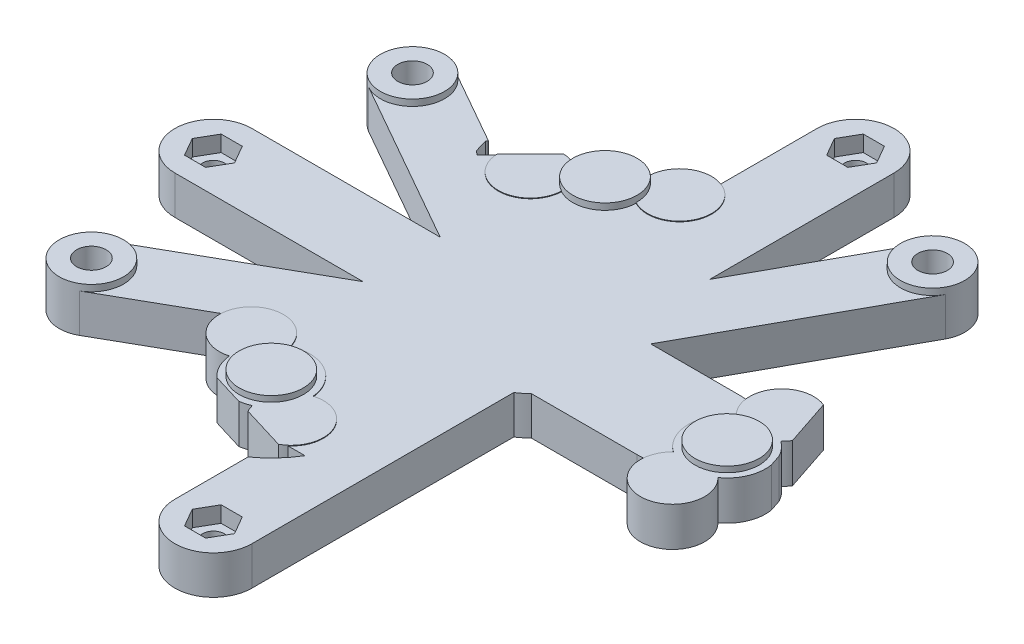
from build123d import *
from build123d.topology import SkipClean

# Parameters (mm, degrees)
BASE_OUTLINE_SKETCH_R          = 3.95
BASE_OUTLINE_SKETCH_R_2        = 1.75
BASE_OUTLINE_SKETCH_R_3        = 3.1
BASE_OUTLINE_SKETCH_R_4        = 2.3
BASE_OUTLINE_DEPTH             = 1.4
INTERFACE_PROFILE_2_SKETCH_R   = 3.95
INTERFACE_PROFILE_2_SKETCH_R_2 = 1.75
INTERFACE_PROFILE_2_SKETCH_R_3 = 1.7
INTERFACE_PROFILE_2_SKETCH_R_4 = 2.3
INTERFACE_PROFILE_2_DEPTH      = 0.1
INTERFACE_PROFILE_3_SKETCH_R   = 1.75
INTERFACE_PROFILE_3_SKETCH_R_2 = 1.7
INTERFACE_PROFILE_3_SKETCH_R_3 = 2.3
INTERFACE_PROFILE_3_DEPTH      = 0.5
INTERFACE_PROFILE_4_SKETCH_R   = 1.75
INTERFACE_PROFILE_4_SKETCH_R_2 = 1.7
INTERFACE_PROFILE_4_SKETCH_R_3 = 2.3
INTERFACE_PROFILE_4_DEPTH      = 1.5
INTERFACE_PROFILE_5_SKETCH_R   = 1.75
INTERFACE_PROFILE_5_SKETCH_R_2 = 2.3
INTERFACE_PROFILE_5_DEPTH      = 0.5
INTERFACE_PROFILE_6_SKETCH_R   = 1.1
INTERFACE_PROFILE_6_SKETCH_R_2 = 2.3
INTERFACE_PROFILE_6_DEPTH      = 1.3
INTERFACE_PROFILE_7_SKETCH_R   = 2.3
INTERFACE_PROFILE_7_DEPTH      = 0.7
INTERFACE_PROFILE_8_SKETCH_R   = 5
INTERFACE_PROFILE_8_SKETCH_R_2 = 2.3
INTERFACE_PROFILE_8_DEPTH      = 0.1
INTERFACE_PROFILE_9_SKETCH_R   = 5
INTERFACE_PROFILE_9_SKETCH_R_2 = 2.3
INTERFACE_PROFILE_9_DEPTH      = 0.9


with BuildPart() as part:
    # Base Outline Sketch → Base Outline (new body)
    with BuildSketch(Plane(origin=(0, -71, 0), x_dir=(1, 0, 0), z_dir=(0, 1, 0))):
        with BuildLine():
            Line((-32.291651246, 8), (-46.185295141, 8))
            Line((-46.185295141, 8), (-29.910571703, 37.590406251))
            ThreePointArc((-29.910571703, 37.590406251), (-31.882057497, 44.381079543), (-38.672730789, 42.409593749))
            Line((-38.672730789, 42.409593749), (-50.291651246, 21.284283828))
            Line((-50.291651246, 21.284283828), (-50.291651246, 50))
            ThreePointArc((-50.291651246, 50), (-56.291651246, 56), (-62.291651246, 50))
            Line((-62.291651246, 50), (-62.291651246, 34.954572734))
            ThreePointArc((-62.291651246, 34.954572734), (-66.315093544, 34.625464052), (-68.784082024, 31.431642464))
            ThreePointArc((-68.784082024, 31.431642464), (-68.883668242, 30.913025667), (-68.927999999, 30.386798062))
            ThreePointArc((-68.927999999, 30.386798062), (-73.791651246, 30.310889132), (-76.289215931, 26.136798062))
            ThreePointArc((-76.289215931, 26.136798062), (-77.35512684, 26.559413065), (-78.489286926, 26.728085547))
            Line((-78.489286926, 26.728085547), (-83.649541024, 21.548414964))
            ThreePointArc((-83.649541024, 21.548414964), (-83.643005829, 21.416889138), (-83.633009125, 21.285581035))
            Line((-83.633009125, 21.285581035), (-83.8107686, 21.386580737))
            Line((-83.8107686, 21.386580737), (-85.20343943, 19.988669705))
            Line((-85.20343943, 19.988669705), (-85.757211082, 20.413215201))
            ThreePointArc((-85.757211082, 20.413215201), (-86.105522751, 21.420146909), (-86.383835717, 22.448628496))
            Line((-86.383835717, 22.448628496), (-86.305419253, 22.677221962))
            Line((-86.305419253, 22.677221962), (-86.256166384, 22.776011296))
            Line((-86.256166384, 22.776011296), (-97.821604208, 29.347282787))
            ThreePointArc((-97.821604208, 29.347282787), (-104.638934033, 27.470047038), (-102.761698284, 20.652717213))
            Line((-102.761698284, 20.652717213), (-76.972915989, 6))
            Line((-76.972915989, 6), (-106.291651246, 6))
            ThreePointArc((-106.291651246, 6), (-112.291651246, 0), (-106.291651246, -6))
            Line((-106.291651246, -6), (-76.972915989, -6))
            Line((-76.972915989, -6), (-102.761698284, -20.652717213))
            ThreePointArc((-102.761698284, -20.652717213), (-105.125718578, -26.277416546), (-100.291651246, -30))
            ThreePointArc((-100.291651246, -30), (-99.0142347, -29.834067332), (-97.821604208, -29.347282787))
            Line((-97.821604208, -29.347282787), (-83.633009125, -21.285581035))
            ThreePointArc((-83.633009125, -21.285581035), (-81.833429855, -25.588743588), (-77.266036714, -26.53458364))
            ThreePointArc((-77.266036714, -26.53458364), (-76.660851993, -28.65876199), (-75.328083566, -30.420042925))
            Line((-75.328083566, -30.420042925), (-70.4166073, -31.916610671))
            ThreePointArc((-70.4166073, -31.916610671), (-69.583050502, -31.73234307), (-68.784082024, -31.431642464))
            ThreePointArc((-68.784082024, -31.431642464), (-68.607205612, -31.999326383), (-68.36419026, -32.541999246))
            Line((-68.36419026, -32.541999246), (-61.538896036, -34.621723271))
            ThreePointArc((-61.538896036, -34.621723271), (-61.075070248, -34.33525847), (-60.645188633, -34))
            Line((-60.645188633, -34), (-58.027344867, -34))
            ThreePointArc((-58.027344867, -34), (-59.924361539, -36.5180637), (-62.291651246, -38.600191578))
            Line((-62.291651246, -38.600191578), (-62.291651246, -50))
            ThreePointArc((-62.291651246, -50), (-56.291651246, -56), (-50.291651246, -50))
            Line((-50.291651246, -50), (-50.291651246, -9.219544457))
            ThreePointArc((-50.291651246, -9.219544457), (-49.489348292, -8.644574861), (-48.741816811, -8))
            Line((-48.741816811, -8), (-32.291651246, -8))
            ThreePointArc((-32.291651246, -8), (-31.774449966, -7.983263921), (-31.259412667, -7.933125709))
            ThreePointArc((-31.259412667, -7.933125709), (-24.59824207, -13.204504795), (-22.824835001, -4.897058824))
            ThreePointArc((-22.824835001, -4.897058824), (-20.756368573, -2.315306833), (-20.370627571, 0.970298223))
            Line((-20.370627571, 0.970298223), (-20.9711323, 2.773459598))
            ThreePointArc((-20.9711323, 2.773459598), (-21.771503753, 3.945664284), (-22.824835001, 4.897058823))
            ThreePointArc((-22.824835001, 4.897058823), (-22.387173453, 5.376691952), (-22.015356327, 5.908995993))
            Line((-22.015356327, 5.908995993), (-24.422675355, 13.137556374))
            ThreePointArc((-24.422675355, 13.137556374), (-29.320205782, 12.478423987), (-31.259412667, 7.933125709))
            ThreePointArc((-31.259412667, 7.933125709), (-31.774449966, 7.983263921), (-32.291651246, 8))
        make_face()
        with Locations(Location((-71.291651246, -25.980762114, 0), (0, 0, 270))):
            Circle(BASE_OUTLINE_SKETCH_R, mode=Mode.SUBTRACT)
        with Locations(Location((-63.930435314, -30.230762114, 0), (0, 0, 270))):
            Circle(BASE_OUTLINE_SKETCH_R_2, mode=Mode.SUBTRACT)
        with Locations(Location((-26.291651246, 0, 0), (0, 0, 270))):
            Circle(BASE_OUTLINE_SKETCH_R, mode=Mode.SUBTRACT)
        with Locations(Location((-56.291651246, -50, 0), (0, 0, 270))):
            Circle(BASE_OUTLINE_SKETCH_R_3, mode=Mode.SUBTRACT)
        with Locations(Location((-26.291651246, -8.5, 0), (0, 0, 270))):
            Circle(BASE_OUTLINE_SKETCH_R_2, mode=Mode.SUBTRACT)
        with Locations(Location((-78.652867178, -21.730762114, 0), (0, 0, 270))):
            Circle(BASE_OUTLINE_SKETCH_R_2, mode=Mode.SUBTRACT)
        with Locations(Location((-100.291651246, -25, 0), (0, 0, 270))):
            Circle(BASE_OUTLINE_SKETCH_R_4, mode=Mode.SUBTRACT)
        with Locations(Location((-71.291651246, 25.980762113, 0), (0, 0, 270))):
            Circle(BASE_OUTLINE_SKETCH_R, mode=Mode.SUBTRACT)
        with Locations(Location((-34.291651246, 40, 0), (0, 0, 270))):
            Circle(BASE_OUTLINE_SKETCH_R_4, mode=Mode.SUBTRACT)
        with Locations(Location((-26.291651246, 8.5, 0), (0, 0, 270))):
            Circle(BASE_OUTLINE_SKETCH_R_2, mode=Mode.SUBTRACT)
        with Locations(Location((-63.930435314, 30.230762113, 0), (0, 0, 270))):
            Circle(BASE_OUTLINE_SKETCH_R_2, mode=Mode.SUBTRACT)
        with Locations(Location((-56.291651246, 50, 0), (0, 0, 270))):
            Circle(BASE_OUTLINE_SKETCH_R_3, mode=Mode.SUBTRACT)
        with Locations(Location((-78.652867178, 21.730762114, 0), (0, 0, 270))):
            Circle(BASE_OUTLINE_SKETCH_R_2, mode=Mode.SUBTRACT)
        with Locations(Location((-106.291651246, 0, 0), (0, 0, 270))):
            Circle(BASE_OUTLINE_SKETCH_R_3, mode=Mode.SUBTRACT)
        with Locations(Location((-100.291651246, 25, 0), (0, 0, 270))):
            Circle(BASE_OUTLINE_SKETCH_R_4, mode=Mode.SUBTRACT)
    extrude(amount=BASE_OUTLINE_DEPTH)

    # Interface Profile 2 Sketch → Interface Profile 2 (add)
    with BuildSketch(Plane(origin=(0, -69.6, 0), x_dir=(1, 0, 0), z_dir=(0, 1, 0))):
        with BuildLine():
            Line((-32.291651246, 8), (-46.185295141, 8))
            Line((-46.185295141, 8), (-29.910571703, 37.590406251))
            ThreePointArc((-29.910571703, 37.590406251), (-31.882057497, 44.381079543), (-38.672730789, 42.409593749))
            Line((-38.672730789, 42.409593749), (-50.291651246, 21.284283828))
            Line((-50.291651246, 21.284283828), (-50.291651246, 50))
            ThreePointArc((-50.291651246, 50), (-56.291651246, 56), (-62.291651246, 50))
            Line((-62.291651246, 50), (-62.291651246, 34.954572734))
            ThreePointArc((-62.291651246, 34.954572734), (-66.315093544, 34.625464052), (-68.784082024, 31.431642464))
            ThreePointArc((-68.784082024, 31.431642464), (-68.883668242, 30.913025667), (-68.927999999, 30.386798062))
            ThreePointArc((-68.927999999, 30.386798062), (-73.791651246, 30.310889132), (-76.289215931, 26.136798062))
            ThreePointArc((-76.289215931, 26.136798062), (-77.35512684, 26.559413065), (-78.489286926, 26.728085547))
            Line((-78.489286926, 26.728085547), (-83.649541024, 21.548414964))
            ThreePointArc((-83.649541024, 21.548414964), (-83.643005829, 21.416889138), (-83.633009125, 21.285581035))
            Line((-83.633009125, 21.285581035), (-83.8107686, 21.386580737))
            Line((-83.8107686, 21.386580737), (-85.20343943, 19.988669705))
            Line((-85.20343943, 19.988669705), (-85.757211082, 20.413215201))
            ThreePointArc((-85.757211082, 20.413215201), (-86.105522751, 21.420146909), (-86.383835717, 22.448628496))
            Line((-86.383835717, 22.448628496), (-86.305419253, 22.677221962))
            Line((-86.305419253, 22.677221962), (-86.256166384, 22.776011296))
            Line((-86.256166384, 22.776011296), (-97.821604208, 29.347282787))
            ThreePointArc((-97.821604208, 29.347282787), (-104.638934033, 27.470047038), (-102.761698284, 20.652717213))
            Line((-102.761698284, 20.652717213), (-76.972915989, 6))
            Line((-76.972915989, 6), (-106.291651246, 6))
            ThreePointArc((-106.291651246, 6), (-112.291651246, 0), (-106.291651246, -6))
            Line((-106.291651246, -6), (-76.972915989, -6))
            Line((-76.972915989, -6), (-102.761698284, -20.652717213))
            ThreePointArc((-102.761698284, -20.652717213), (-105.125718578, -26.277416546), (-100.291651246, -30))
            ThreePointArc((-100.291651246, -30), (-99.0142347, -29.834067332), (-97.821604208, -29.347282787))
            Line((-97.821604208, -29.347282787), (-83.633009125, -21.285581035))
            ThreePointArc((-83.633009125, -21.285581035), (-81.833429855, -25.588743588), (-77.266036714, -26.53458364))
            ThreePointArc((-77.266036714, -26.53458364), (-76.660851993, -28.65876199), (-75.328083566, -30.420042925))
            Line((-75.328083566, -30.420042925), (-70.4166073, -31.916610671))
            ThreePointArc((-70.4166073, -31.916610671), (-69.583050502, -31.73234307), (-68.784082024, -31.431642464))
            ThreePointArc((-68.784082024, -31.431642464), (-68.607205612, -31.999326383), (-68.36419026, -32.541999246))
            Line((-68.36419026, -32.541999246), (-61.538896036, -34.621723271))
            ThreePointArc((-61.538896036, -34.621723271), (-61.075070248, -34.33525847), (-60.645188633, -34))
            Line((-60.645188633, -34), (-58.027344867, -34))
            ThreePointArc((-58.027344867, -34), (-59.924361539, -36.5180637), (-62.291651246, -38.600191578))
            Line((-62.291651246, -38.600191578), (-62.291651246, -50))
            ThreePointArc((-62.291651246, -50), (-56.291651246, -56), (-50.291651246, -50))
            Line((-50.291651246, -50), (-50.291651246, -9.219544457))
            ThreePointArc((-50.291651246, -9.219544457), (-49.489348292, -8.644574861), (-48.741816811, -8))
            Line((-48.741816811, -8), (-32.291651246, -8))
            ThreePointArc((-32.291651246, -8), (-31.774449966, -7.983263921), (-31.259412667, -7.933125709))
            ThreePointArc((-31.259412667, -7.933125709), (-24.59824207, -13.204504795), (-22.824835001, -4.897058824))
            ThreePointArc((-22.824835001, -4.897058824), (-20.756368573, -2.315306833), (-20.370627571, 0.970298223))
            Line((-20.370627571, 0.970298223), (-20.9711323, 2.773459598))
            ThreePointArc((-20.9711323, 2.773459598), (-21.771503753, 3.945664284), (-22.824835001, 4.897058823))
            ThreePointArc((-22.824835001, 4.897058823), (-22.387173453, 5.376691952), (-22.015356327, 5.908995993))
            Line((-22.015356327, 5.908995993), (-24.422675355, 13.137556374))
            ThreePointArc((-24.422675355, 13.137556374), (-29.320205782, 12.478423987), (-31.259412667, 7.933125709))
            ThreePointArc((-31.259412667, 7.933125709), (-31.774449966, 7.983263921), (-32.291651246, 8))
        make_face()
        with Locations(Location((-71.291651246, -25.980762114, 0), (0, 0, 270))):
            Circle(INTERFACE_PROFILE_2_SKETCH_R, mode=Mode.SUBTRACT)
        with Locations(Location((-63.930435314, -30.230762114, 0), (0, 0, 270))):
            Circle(INTERFACE_PROFILE_2_SKETCH_R_2, mode=Mode.SUBTRACT)
        with Locations(Location((-26.291651246, 0, 0), (0, 0, 270))):
            Circle(INTERFACE_PROFILE_2_SKETCH_R, mode=Mode.SUBTRACT)
        with Locations(Location((-56.291651246, -50, 0), (0, 0, 270))):
            Circle(INTERFACE_PROFILE_2_SKETCH_R_3, mode=Mode.SUBTRACT)
        with Locations(Location((-56.291651246, 50, 0), (0, 0, 270))):
            Circle(INTERFACE_PROFILE_2_SKETCH_R_3, mode=Mode.SUBTRACT)
        with Locations(Location((-106.291651246, 0, 0), (0, 0, 270))):
            Circle(INTERFACE_PROFILE_2_SKETCH_R_3, mode=Mode.SUBTRACT)
        with Locations(Location((-26.291651246, -8.5, 0), (0, 0, 270))):
            Circle(INTERFACE_PROFILE_2_SKETCH_R_2, mode=Mode.SUBTRACT)
        with Locations(Location((-78.652867178, -21.730762114, 0), (0, 0, 270))):
            Circle(INTERFACE_PROFILE_2_SKETCH_R_2, mode=Mode.SUBTRACT)
        with Locations(Location((-100.291651246, -25, 0), (0, 0, 270))):
            Circle(INTERFACE_PROFILE_2_SKETCH_R_4, mode=Mode.SUBTRACT)
        with Locations(Location((-71.291651246, 25.980762113, 0), (0, 0, 270))):
            Circle(INTERFACE_PROFILE_2_SKETCH_R, mode=Mode.SUBTRACT)
        with Locations(Location((-34.291651246, 40, 0), (0, 0, 270))):
            Circle(INTERFACE_PROFILE_2_SKETCH_R_4, mode=Mode.SUBTRACT)
        with Locations(Location((-26.291651246, 8.5, 0), (0, 0, 270))):
            Circle(INTERFACE_PROFILE_2_SKETCH_R_2, mode=Mode.SUBTRACT)
        with Locations(Location((-63.930435314, 30.230762113, 0), (0, 0, 270))):
            Circle(INTERFACE_PROFILE_2_SKETCH_R_2, mode=Mode.SUBTRACT)
        with Locations(Location((-78.652867178, 21.730762114, 0), (0, 0, 270))):
            Circle(INTERFACE_PROFILE_2_SKETCH_R_2, mode=Mode.SUBTRACT)
        with Locations(Location((-100.291651246, 25, 0), (0, 0, 270))):
            Circle(INTERFACE_PROFILE_2_SKETCH_R_4, mode=Mode.SUBTRACT)
    extrude(amount=INTERFACE_PROFILE_2_DEPTH)

    # Interface Profile 3 Sketch → Interface Profile 3 (add)
    with SkipClean():  # the faces are left unmerged after this step: merging them gives an invalid solid
        with BuildSketch(Plane(origin=(0, -69.5, 0), x_dir=(1, 0, 0), z_dir=(0, 1, 0))):
            with BuildLine():
                Line((-32.291651246, 8), (-46.185295141, 8))
                Line((-46.185295141, 8), (-29.910571703, 37.590406251))
                ThreePointArc((-29.910571703, 37.590406251), (-31.882057497, 44.381079543), (-38.672730789, 42.409593749))
                Line((-38.672730789, 42.409593749), (-50.291651246, 21.284283828))
                Line((-50.291651246, 21.284283828), (-50.291651246, 50))
                ThreePointArc((-50.291651246, 50), (-56.291651246, 56), (-62.291651246, 50))
                Line((-62.291651246, 50), (-62.291651246, 34.954572734))
                ThreePointArc((-62.291651246, 34.954572734), (-66.315093544, 34.625464052), (-68.784082024, 31.431642464))
                ThreePointArc((-68.784082024, 31.431642464), (-68.883668242, 30.913025667), (-68.927999999, 30.386798062))
                ThreePointArc((-68.927999999, 30.386798062), (-73.791651246, 30.310889132), (-76.289215931, 26.136798062))
                ThreePointArc((-76.289215931, 26.136798062), (-77.35512684, 26.559413065), (-78.489286926, 26.728085547))
                Line((-78.489286926, 26.728085547), (-83.649541024, 21.548414964))
                ThreePointArc((-83.649541024, 21.548414964), (-83.643005829, 21.416889138), (-83.633009125, 21.285581035))
                Line((-83.633009125, 21.285581035), (-83.8107686, 21.386580737))
                Line((-83.8107686, 21.386580737), (-85.20343943, 19.988669705))
                Line((-85.20343943, 19.988669705), (-85.757211082, 20.413215201))
                ThreePointArc((-85.757211082, 20.413215201), (-86.105522751, 21.420146909), (-86.383835717, 22.448628496))
                Line((-86.383835717, 22.448628496), (-86.305419253, 22.677221962))
                Line((-86.305419253, 22.677221962), (-86.256166384, 22.776011296))
                Line((-86.256166384, 22.776011296), (-97.821604208, 29.347282787))
                ThreePointArc((-97.821604208, 29.347282787), (-104.638934033, 27.470047038), (-102.761698284, 20.652717213))
                Line((-102.761698284, 20.652717213), (-76.972915989, 6))
                Line((-76.972915989, 6), (-106.291651246, 6))
                ThreePointArc((-106.291651246, 6), (-112.291651246, 0), (-106.291651246, -6))
                Line((-106.291651246, -6), (-76.972915989, -6))
                Line((-76.972915989, -6), (-102.761698284, -20.652717213))
                ThreePointArc((-102.761698284, -20.652717213), (-105.125718578, -26.277416546), (-100.291651246, -30))
                ThreePointArc((-100.291651246, -30), (-99.0142347, -29.834067332), (-97.821604208, -29.347282787))
                Line((-97.821604208, -29.347282787), (-83.633009125, -21.285581035))
                ThreePointArc((-83.633009125, -21.285581035), (-81.833429855, -25.588743588), (-77.266036714, -26.53458364))
                ThreePointArc((-77.266036714, -26.53458364), (-76.660851993, -28.65876199), (-75.328083566, -30.420042925))
                Line((-75.328083566, -30.420042925), (-70.4166073, -31.916610671))
                ThreePointArc((-70.4166073, -31.916610671), (-69.583050502, -31.73234307), (-68.784082024, -31.431642464))
                ThreePointArc((-68.784082024, -31.431642464), (-68.607205612, -31.999326383), (-68.36419026, -32.541999246))
                Line((-68.36419026, -32.541999246), (-61.538896036, -34.621723271))
                ThreePointArc((-61.538896036, -34.621723271), (-61.075070248, -34.33525847), (-60.645188633, -34))
                Line((-60.645188633, -34), (-58.027344867, -34))
                ThreePointArc((-58.027344867, -34), (-59.924361539, -36.5180637), (-62.291651246, -38.600191578))
                Line((-62.291651246, -38.600191578), (-62.291651246, -50))
                ThreePointArc((-62.291651246, -50), (-56.291651246, -56), (-50.291651246, -50))
                Line((-50.291651246, -50), (-50.291651246, -9.219544457))
                ThreePointArc((-50.291651246, -9.219544457), (-49.489348292, -8.644574861), (-48.741816811, -8))
                Line((-48.741816811, -8), (-32.291651246, -8))
                ThreePointArc((-32.291651246, -8), (-31.774449966, -7.983263921), (-31.259412667, -7.933125709))
                ThreePointArc((-31.259412667, -7.933125709), (-24.59824207, -13.204504794), (-22.824835001, -4.897058824))
                ThreePointArc((-22.824835001, -4.897058824), (-20.756368573, -2.315306833), (-20.370627571, 0.970298223))
                Line((-20.370627571, 0.970298223), (-20.9711323, 2.773459598))
                ThreePointArc((-20.9711323, 2.773459598), (-21.771503753, 3.945664284), (-22.824835001, 4.897058824))
                ThreePointArc((-22.824835001, 4.897058824), (-22.387173453, 5.376691952), (-22.015356327, 5.908995993))
                Line((-22.015356327, 5.908995993), (-24.422675355, 13.137556374))
                ThreePointArc((-24.422675355, 13.137556374), (-29.320205782, 12.478423987), (-31.259412667, 7.933125709))
                ThreePointArc((-31.259412667, 7.933125709), (-31.774449966, 7.983263921), (-32.291651246, 8))
            make_face()
            with Locations(Location((-63.930435314, -30.230762114, 0), (0, 0, 270))):
                Circle(INTERFACE_PROFILE_3_SKETCH_R, mode=Mode.SUBTRACT)
            with Locations(Location((-56.291651246, -50, 0), (0, 0, 270))):
                Circle(INTERFACE_PROFILE_3_SKETCH_R_2, mode=Mode.SUBTRACT)
            with Locations(Location((-56.291651246, 50, 0), (0, 0, 270.000000001))):
                Circle(INTERFACE_PROFILE_3_SKETCH_R_2, mode=Mode.SUBTRACT)
            with Locations(Location((-106.291651246, 0, 0), (0, 0, 270))):
                Circle(INTERFACE_PROFILE_3_SKETCH_R_2, mode=Mode.SUBTRACT)
            with Locations(Location((-26.291651246, -8.5, 0), (0, 0, 270))):
                Circle(INTERFACE_PROFILE_3_SKETCH_R, mode=Mode.SUBTRACT)
            with Locations(Location((-78.652867178, -21.730762114, 0), (0, 0, 270))):
                Circle(INTERFACE_PROFILE_3_SKETCH_R, mode=Mode.SUBTRACT)
            with Locations(Location((-100.291651246, -25, 0), (0, 0, 270))):
                Circle(INTERFACE_PROFILE_3_SKETCH_R_3, mode=Mode.SUBTRACT)
            with Locations(Location((-34.291651246, 40, 0), (0, 0, 270.000000001))):
                Circle(INTERFACE_PROFILE_3_SKETCH_R_3, mode=Mode.SUBTRACT)
            with Locations(Location((-26.291651246, 8.5, 0), (0, 0, 270))):
                Circle(INTERFACE_PROFILE_3_SKETCH_R, mode=Mode.SUBTRACT)
            with Locations(Location((-63.930435314, 30.230762114, 0), (0, 0, 270.000000001))):
                Circle(INTERFACE_PROFILE_3_SKETCH_R, mode=Mode.SUBTRACT)
            with Locations(Location((-78.652867178, 21.730762114, 0), (0, 0, 270))):
                Circle(INTERFACE_PROFILE_3_SKETCH_R, mode=Mode.SUBTRACT)
            with Locations(Location((-100.291651246, 25, 0), (0, 0, 270))):
                Circle(INTERFACE_PROFILE_3_SKETCH_R_3, mode=Mode.SUBTRACT)
            with BuildLine():
                Line((-70.802674502, -29.900379664), (-74.93062799, -27.517104607))
                ThreePointArc((-74.93062799, -27.517104607), (-72.075405627, -22.109298686), (-67.341651246, -25.980762114))
                ThreePointArc((-67.341651246, -25.980762114), (-68.330742759, -28.595245032), (-70.802674502, -29.900379664))
            make_face(mode=Mode.SUBTRACT)
            with BuildLine():
                Line((-23.141651246, 2.383275058), (-23.141651246, -2.383275058))
                ThreePointArc((-23.141651246, -2.383275058), (-30.241651246, 0), (-23.141651246, 2.383275058))
            make_face(mode=Mode.SUBTRACT)
            with BuildLine():
                Line((-74.93062799, 27.517104607), (-70.802674502, 29.900379664))
                ThreePointArc((-70.802674502, 29.900379664), (-68.330742759, 28.595245032), (-67.341651246, 25.980762114))
                ThreePointArc((-67.341651246, 25.980762114), (-72.075405627, 22.109298686), (-74.93062799, 27.517104607))
            make_face(mode=Mode.SUBTRACT)
        extrude(amount=INTERFACE_PROFILE_3_DEPTH)

    # Interface Profile 4 Sketch → Interface Profile 4 (add)
    with SkipClean():  # the faces are left unmerged after this step: merging them gives an invalid solid
        with BuildSketch(Plane(origin=(0, -69, 0), x_dir=(1, 0, 0), z_dir=(0, 1, 0))):
            with BuildLine():
                Line((-32.291651246, 8), (-46.185295141, 8))
                Line((-46.185295141, 8), (-29.910571703, 37.590406251))
                ThreePointArc((-29.910571703, 37.590406251), (-31.882057497, 44.381079543), (-38.672730789, 42.409593749))
                Line((-38.672730789, 42.409593749), (-50.291651246, 21.284283828))
                Line((-50.291651246, 21.284283828), (-50.291651246, 50))
                ThreePointArc((-50.291651246, 50), (-56.291651246, 56), (-62.291651246, 50))
                Line((-62.291651246, 50), (-62.291651246, 34.954572734))
                ThreePointArc((-62.291651246, 34.954572734), (-66.315093544, 34.625464052), (-68.784082024, 31.431642464))
                ThreePointArc((-68.784082024, 31.431642464), (-68.883668242, 30.913025667), (-68.927999999, 30.386798062))
                ThreePointArc((-68.927999999, 30.386798062), (-73.791651246, 30.310889132), (-76.289215931, 26.136798062))
                ThreePointArc((-76.289215931, 26.136798062), (-77.35512684, 26.559413065), (-78.489286926, 26.728085547))
                Line((-78.489286926, 26.728085547), (-83.649541024, 21.548414964))
                ThreePointArc((-83.649541024, 21.548414964), (-83.643005829, 21.416889138), (-83.633009125, 21.285581035))
                Line((-83.633009125, 21.285581035), (-83.8107686, 21.386580737))
                Line((-83.8107686, 21.386580737), (-85.20343943, 19.988669705))
                Line((-85.20343943, 19.988669705), (-85.757211082, 20.413215201))
                ThreePointArc((-85.757211082, 20.413215201), (-86.105522751, 21.420146909), (-86.383835717, 22.448628496))
                Line((-86.383835717, 22.448628496), (-86.305419253, 22.677221962))
                Line((-86.305419253, 22.677221962), (-86.256166384, 22.776011296))
                Line((-86.256166384, 22.776011296), (-97.821604208, 29.347282787))
                ThreePointArc((-97.821604208, 29.347282787), (-104.638934033, 27.470047038), (-102.761698284, 20.652717213))
                Line((-102.761698284, 20.652717213), (-76.972915989, 6))
                Line((-76.972915989, 6), (-106.291651246, 6))
                ThreePointArc((-106.291651246, 6), (-112.291651246, 0), (-106.291651246, -6))
                Line((-106.291651246, -6), (-76.972915989, -6))
                Line((-76.972915989, -6), (-102.761698284, -20.652717213))
                ThreePointArc((-102.761698284, -20.652717213), (-105.125718578, -26.277416546), (-100.291651246, -30))
                ThreePointArc((-100.291651246, -30), (-99.0142347, -29.834067332), (-97.821604208, -29.347282787))
                Line((-97.821604208, -29.347282787), (-83.633009125, -21.285581035))
                ThreePointArc((-83.633009125, -21.285581035), (-81.833429855, -25.588743588), (-77.266036714, -26.53458364))
                ThreePointArc((-77.266036714, -26.53458364), (-76.660851993, -28.65876199), (-75.328083566, -30.420042925))
                Line((-75.328083566, -30.420042925), (-70.4166073, -31.916610671))
                ThreePointArc((-70.4166073, -31.916610671), (-69.583050502, -31.73234307), (-68.784082024, -31.431642464))
                ThreePointArc((-68.784082024, -31.431642464), (-68.607205612, -31.999326383), (-68.36419026, -32.541999246))
                Line((-68.36419026, -32.541999246), (-61.538896036, -34.621723271))
                ThreePointArc((-61.538896036, -34.621723271), (-61.075070248, -34.33525847), (-60.645188633, -34))
                Line((-60.645188633, -34), (-58.027344867, -34))
                ThreePointArc((-58.027344867, -34), (-59.924361539, -36.5180637), (-62.291651246, -38.600191578))
                Line((-62.291651246, -38.600191578), (-62.291651246, -50))
                ThreePointArc((-62.291651246, -50), (-56.291651246, -56), (-50.291651246, -50))
                Line((-50.291651246, -50), (-50.291651246, -9.219544457))
                ThreePointArc((-50.291651246, -9.219544457), (-49.489348292, -8.644574861), (-48.741816811, -8))
                Line((-48.741816811, -8), (-32.291651246, -8))
                ThreePointArc((-32.291651246, -8), (-31.774449966, -7.983263921), (-31.259412667, -7.933125709))
                ThreePointArc((-31.259412667, -7.933125709), (-24.59824207, -13.204504795), (-22.824835001, -4.897058824))
                ThreePointArc((-22.824835001, -4.897058824), (-20.756368573, -2.315306833), (-20.370627571, 0.970298223))
                Line((-20.370627571, 0.970298223), (-20.9711323, 2.773459598))
                ThreePointArc((-20.9711323, 2.773459598), (-21.771503753, 3.945664284), (-22.824835001, 4.897058823))
                ThreePointArc((-22.824835001, 4.897058823), (-22.387173453, 5.376691952), (-22.015356327, 5.908995993))
                Line((-22.015356327, 5.908995993), (-24.422675355, 13.137556374))
                ThreePointArc((-24.422675355, 13.137556374), (-29.320205782, 12.478423987), (-31.259412667, 7.933125709))
                ThreePointArc((-31.259412667, 7.933125709), (-31.774449966, 7.983263921), (-32.291651246, 8))
            make_face()
            with Locations(Location((-63.930435314, -30.230762114, 0), (0, 0, 270))):
                Circle(INTERFACE_PROFILE_4_SKETCH_R, mode=Mode.SUBTRACT)
            with Locations(Location((-56.291651246, -50, 0), (0, 0, 270))):
                Circle(INTERFACE_PROFILE_4_SKETCH_R_2, mode=Mode.SUBTRACT)
            with Locations(Location((-56.291651246, 50, 0), (0, 0, 270))):
                Circle(INTERFACE_PROFILE_4_SKETCH_R_2, mode=Mode.SUBTRACT)
            with Locations(Location((-106.291651246, 0, 0), (0, 0, 270))):
                Circle(INTERFACE_PROFILE_4_SKETCH_R_2, mode=Mode.SUBTRACT)
            with Locations(Location((-26.291651246, -8.5, 0), (0, 0, 270))):
                Circle(INTERFACE_PROFILE_4_SKETCH_R, mode=Mode.SUBTRACT)
            with Locations(Location((-78.652867178, -21.730762114, 0), (0, 0, 270))):
                Circle(INTERFACE_PROFILE_4_SKETCH_R, mode=Mode.SUBTRACT)
            with Locations(Location((-100.291651246, -25, 0), (0, 0, 270))):
                Circle(INTERFACE_PROFILE_4_SKETCH_R_3, mode=Mode.SUBTRACT)
            with Locations(Location((-34.291651246, 40, 0), (0, 0, 270))):
                Circle(INTERFACE_PROFILE_4_SKETCH_R_3, mode=Mode.SUBTRACT)
            with Locations(Location((-26.291651246, 8.5, 0), (0, 0, 270))):
                Circle(INTERFACE_PROFILE_4_SKETCH_R, mode=Mode.SUBTRACT)
            with Locations(Location((-63.930435314, 30.230762113, 0), (0, 0, 270))):
                Circle(INTERFACE_PROFILE_4_SKETCH_R, mode=Mode.SUBTRACT)
            with Locations(Location((-78.652867178, 21.730762114, 0), (0, 0, 270))):
                Circle(INTERFACE_PROFILE_4_SKETCH_R, mode=Mode.SUBTRACT)
            with Locations(Location((-100.291651246, 25, 0), (0, 0, 270))):
                Circle(INTERFACE_PROFILE_4_SKETCH_R_3, mode=Mode.SUBTRACT)
        extrude(amount=INTERFACE_PROFILE_4_DEPTH)

    # Interface Profile 5 Sketch → Interface Profile 5 (add)
    with SkipClean():  # the faces are left unmerged after this step: merging them gives an invalid solid
        with BuildSketch(Plane(origin=(0, -67.5, 0), x_dir=(1, 0, 0), z_dir=(0, 1, 0))):
            with BuildLine():
                Line((-32.291651246, 8), (-46.185295141, 8))
                Line((-46.185295141, 8), (-29.910571703, 37.590406251))
                ThreePointArc((-29.910571703, 37.590406251), (-31.882057497, 44.381079543), (-38.672730789, 42.409593749))
                Line((-38.672730789, 42.409593749), (-50.291651246, 21.284283828))
                Line((-50.291651246, 21.284283828), (-50.291651246, 50))
                ThreePointArc((-50.291651246, 50), (-56.291651246, 56), (-62.291651246, 50))
                Line((-62.291651246, 50), (-62.291651246, 34.954572734))
                ThreePointArc((-62.291651246, 34.954572734), (-66.315093544, 34.625464052), (-68.784082024, 31.431642464))
                ThreePointArc((-68.784082024, 31.431642464), (-68.883668242, 30.913025667), (-68.927999999, 30.386798062))
                ThreePointArc((-68.927999999, 30.386798062), (-73.791651246, 30.310889132), (-76.289215931, 26.136798062))
                ThreePointArc((-76.289215931, 26.136798062), (-77.35512684, 26.559413065), (-78.489286926, 26.728085547))
                Line((-78.489286926, 26.728085547), (-83.649541024, 21.548414964))
                ThreePointArc((-83.649541024, 21.548414964), (-83.643005829, 21.416889138), (-83.633009125, 21.285581035))
                Line((-83.633009125, 21.285581035), (-83.8107686, 21.386580737))
                Line((-83.8107686, 21.386580737), (-85.20343943, 19.988669705))
                Line((-85.20343943, 19.988669705), (-85.757211082, 20.413215201))
                ThreePointArc((-85.757211082, 20.413215201), (-86.105522751, 21.420146909), (-86.383835717, 22.448628496))
                Line((-86.383835717, 22.448628496), (-86.305419253, 22.677221962))
                Line((-86.305419253, 22.677221962), (-86.256166384, 22.776011296))
                Line((-86.256166384, 22.776011296), (-97.821604208, 29.347282787))
                ThreePointArc((-97.821604208, 29.347282787), (-104.638934033, 27.470047038), (-102.761698284, 20.652717213))
                Line((-102.761698284, 20.652717213), (-76.972915989, 6))
                Line((-76.972915989, 6), (-106.291651246, 6))
                ThreePointArc((-106.291651246, 6), (-112.291651246, 0), (-106.291651246, -6))
                Line((-106.291651246, -6), (-76.972915989, -6))
                Line((-76.972915989, -6), (-102.761698284, -20.652717213))
                ThreePointArc((-102.761698284, -20.652717213), (-105.125718578, -26.277416546), (-100.291651246, -30))
                ThreePointArc((-100.291651246, -30), (-99.0142347, -29.834067332), (-97.821604208, -29.347282787))
                Line((-97.821604208, -29.347282787), (-83.633009125, -21.285581035))
                ThreePointArc((-83.633009125, -21.285581035), (-81.833429855, -25.588743588), (-77.266036714, -26.53458364))
                ThreePointArc((-77.266036714, -26.53458364), (-76.660851993, -28.65876199), (-75.328083566, -30.420042925))
                Line((-75.328083566, -30.420042925), (-70.4166073, -31.916610671))
                ThreePointArc((-70.4166073, -31.916610671), (-69.583050502, -31.73234307), (-68.784082024, -31.431642464))
                ThreePointArc((-68.784082024, -31.431642464), (-68.607205612, -31.999326383), (-68.36419026, -32.541999246))
                Line((-68.36419026, -32.541999246), (-61.538896036, -34.621723271))
                ThreePointArc((-61.538896036, -34.621723271), (-61.075070248, -34.33525847), (-60.645188633, -34))
                Line((-60.645188633, -34), (-58.027344867, -34))
                ThreePointArc((-58.027344867, -34), (-59.924361539, -36.5180637), (-62.291651246, -38.600191578))
                Line((-62.291651246, -38.600191578), (-62.291651246, -50))
                ThreePointArc((-62.291651246, -50), (-56.291651246, -56), (-50.291651246, -50))
                Line((-50.291651246, -50), (-50.291651246, -9.219544457))
                ThreePointArc((-50.291651246, -9.219544457), (-49.489348292, -8.644574861), (-48.741816811, -8))
                Line((-48.741816811, -8), (-32.291651246, -8))
                ThreePointArc((-32.291651246, -8), (-31.774449966, -7.983263921), (-31.259412667, -7.933125709))
                ThreePointArc((-31.259412667, -7.933125709), (-24.59824207, -13.204504795), (-22.824835001, -4.897058824))
                ThreePointArc((-22.824835001, -4.897058824), (-20.756368573, -2.315306833), (-20.370627571, 0.970298223))
                Line((-20.370627571, 0.970298223), (-20.9711323, 2.773459598))
                ThreePointArc((-20.9711323, 2.773459598), (-21.771503753, 3.945664284), (-22.824835001, 4.897058823))
                ThreePointArc((-22.824835001, 4.897058823), (-22.387173453, 5.376691952), (-22.015356327, 5.908995993))
                Line((-22.015356327, 5.908995993), (-24.422675355, 13.137556374))
                ThreePointArc((-24.422675355, 13.137556374), (-29.320205782, 12.478423987), (-31.259412667, 7.933125709))
                ThreePointArc((-31.259412667, 7.933125709), (-31.774449966, 7.983263921), (-32.291651246, 8))
            make_face()
            with Locations(Location((-63.930435314, -30.230762114, 0), (0, 0, 270))):
                Circle(INTERFACE_PROFILE_5_SKETCH_R, mode=Mode.SUBTRACT)
            with Locations(Location((-26.291651246, -8.5, 0), (0, 0, 270))):
                Circle(INTERFACE_PROFILE_5_SKETCH_R, mode=Mode.SUBTRACT)
            with Locations(Location((-78.652867178, -21.730762114, 0), (0, 0, 270))):
                Circle(INTERFACE_PROFILE_5_SKETCH_R, mode=Mode.SUBTRACT)
            with Locations(Location((-100.291651246, -25, 0), (0, 0, 270))):
                Circle(INTERFACE_PROFILE_5_SKETCH_R_2, mode=Mode.SUBTRACT)
            with Locations(Location((-34.291651246, 40, 0), (0, 0, 270))):
                Circle(INTERFACE_PROFILE_5_SKETCH_R_2, mode=Mode.SUBTRACT)
            with Locations(Location((-26.291651246, 8.5, 0), (0, 0, 270))):
                Circle(INTERFACE_PROFILE_5_SKETCH_R, mode=Mode.SUBTRACT)
            with Locations(Location((-63.930435314, 30.230762113, 0), (0, 0, 270))):
                Circle(INTERFACE_PROFILE_5_SKETCH_R, mode=Mode.SUBTRACT)
            with Locations(Location((-78.652867178, 21.730762114, 0), (0, 0, 270))):
                Circle(INTERFACE_PROFILE_5_SKETCH_R, mode=Mode.SUBTRACT)
            with Locations(Location((-100.291651246, 25, 0), (0, 0, 270))):
                Circle(INTERFACE_PROFILE_5_SKETCH_R_2, mode=Mode.SUBTRACT)
            Polygon((-59.58254778, -50), (-57.937099513, -47.15), (-54.646202979, -47.15), (-53.000754712, -50), (-54.646202979, -52.85), (-57.937099513, -52.85), align=None, mode=Mode.SUBTRACT)
            Polygon((-54.646202979, 52.85), (-53.000754712, 50), (-54.646202979, 47.15), (-57.937099513, 47.15), (-59.58254778, 50), (-57.937099513, 52.85), align=None, mode=Mode.SUBTRACT)
            Polygon((-104.646202979, 2.85), (-103.000754712, 0), (-104.646202979, -2.85), (-107.937099513, -2.85), (-109.58254778, 0), (-107.937099513, 2.85), align=None, mode=Mode.SUBTRACT)
        extrude(amount=INTERFACE_PROFILE_5_DEPTH)

    # Interface Profile 6 Sketch → Interface Profile 6 (add)
    with SkipClean():  # the faces are left unmerged after this step: merging them gives an invalid solid
        with BuildSketch(Plane(origin=(0, -67, 0), x_dir=(1, 0, 0), z_dir=(0, 1, 0))):
            with BuildLine():
                Line((-32.291651246, 8), (-46.185295141, 8))
                Line((-46.185295141, 8), (-29.910571703, 37.590406251))
                ThreePointArc((-29.910571703, 37.590406251), (-31.882057497, 44.381079543), (-38.672730789, 42.409593749))
                Line((-38.672730789, 42.409593749), (-50.291651246, 21.284283828))
                Line((-50.291651246, 21.284283828), (-50.291651246, 50))
                ThreePointArc((-50.291651246, 50), (-56.291651246, 56), (-62.291651246, 50))
                Line((-62.291651246, 50), (-62.291651246, 34.954572734))
                ThreePointArc((-62.291651246, 34.954572734), (-66.315093544, 34.625464052), (-68.784082024, 31.431642464))
                ThreePointArc((-68.784082024, 31.431642464), (-68.883668242, 30.913025667), (-68.927999999, 30.386798062))
                ThreePointArc((-68.927999999, 30.386798062), (-73.791651246, 30.310889132), (-76.289215931, 26.136798062))
                ThreePointArc((-76.289215931, 26.136798062), (-77.35512684, 26.559413065), (-78.489286926, 26.728085547))
                Line((-78.489286926, 26.728085547), (-83.649541024, 21.548414964))
                ThreePointArc((-83.649541024, 21.548414964), (-83.643005829, 21.416889138), (-83.633009125, 21.285581035))
                Line((-83.633009125, 21.285581035), (-83.8107686, 21.386580737))
                Line((-83.8107686, 21.386580737), (-85.20343943, 19.988669705))
                Line((-85.20343943, 19.988669705), (-85.757211082, 20.413215201))
                ThreePointArc((-85.757211082, 20.413215201), (-86.105522751, 21.420146909), (-86.383835717, 22.448628496))
                Line((-86.383835717, 22.448628496), (-86.305419253, 22.677221962))
                Line((-86.305419253, 22.677221962), (-86.256166384, 22.776011296))
                Line((-86.256166384, 22.776011296), (-97.821604208, 29.347282787))
                ThreePointArc((-97.821604208, 29.347282787), (-104.638934033, 27.470047038), (-102.761698284, 20.652717213))
                Line((-102.761698284, 20.652717213), (-76.972915989, 6))
                Line((-76.972915989, 6), (-106.291651246, 6))
                ThreePointArc((-106.291651246, 6), (-112.291651246, 0), (-106.291651246, -6))
                Line((-106.291651246, -6), (-76.972915989, -6))
                Line((-76.972915989, -6), (-102.761698284, -20.652717213))
                ThreePointArc((-102.761698284, -20.652717213), (-105.125718578, -26.277416546), (-100.291651246, -30))
                ThreePointArc((-100.291651246, -30), (-99.0142347, -29.834067332), (-97.821604208, -29.347282787))
                Line((-97.821604208, -29.347282787), (-83.633009125, -21.285581035))
                ThreePointArc((-83.633009125, -21.285581035), (-81.833429855, -25.588743588), (-77.266036714, -26.53458364))
                ThreePointArc((-77.266036714, -26.53458364), (-76.660851993, -28.65876199), (-75.328083566, -30.420042925))
                Line((-75.328083566, -30.420042925), (-70.4166073, -31.916610671))
                ThreePointArc((-70.4166073, -31.916610671), (-69.583050502, -31.73234307), (-68.784082024, -31.431642464))
                ThreePointArc((-68.784082024, -31.431642464), (-68.607205612, -31.999326383), (-68.36419026, -32.541999246))
                Line((-68.36419026, -32.541999246), (-61.538896036, -34.621723271))
                ThreePointArc((-61.538896036, -34.621723271), (-61.075070248, -34.33525847), (-60.645188633, -34))
                Line((-60.645188633, -34), (-58.027344867, -34))
                ThreePointArc((-58.027344867, -34), (-59.924361539, -36.5180637), (-62.291651246, -38.600191578))
                Line((-62.291651246, -38.600191578), (-62.291651246, -50))
                ThreePointArc((-62.291651246, -50), (-56.291651246, -56), (-50.291651246, -50))
                Line((-50.291651246, -50), (-50.291651246, -9.219544457))
                ThreePointArc((-50.291651246, -9.219544457), (-49.489348292, -8.644574861), (-48.741816811, -8))
                Line((-48.741816811, -8), (-32.291651246, -8))
                ThreePointArc((-32.291651246, -8), (-31.774449966, -7.983263921), (-31.259412667, -7.933125709))
                ThreePointArc((-31.259412667, -7.933125709), (-24.59824207, -13.204504795), (-22.824835001, -4.897058824))
                ThreePointArc((-22.824835001, -4.897058824), (-20.756368573, -2.315306833), (-20.370627571, 0.970298223))
                Line((-20.370627571, 0.970298223), (-20.9711323, 2.773459598))
                ThreePointArc((-20.9711323, 2.773459598), (-21.771503753, 3.945664284), (-22.824835001, 4.897058823))
                ThreePointArc((-22.824835001, 4.897058823), (-22.387173453, 5.376691952), (-22.015356327, 5.908995993))
                Line((-22.015356327, 5.908995993), (-24.422675355, 13.137556374))
                ThreePointArc((-24.422675355, 13.137556374), (-29.320205782, 12.478423987), (-31.259412667, 7.933125709))
                ThreePointArc((-31.259412667, 7.933125709), (-31.774449966, 7.983263921), (-32.291651246, 8))
            make_face()
            with Locations(Location((-63.930435314, -30.230762114, 0), (0, 0, 270))):
                Circle(INTERFACE_PROFILE_6_SKETCH_R, mode=Mode.SUBTRACT)
            with Locations(Location((-26.291651246, -8.5, 0), (0, 0, 270))):
                Circle(INTERFACE_PROFILE_6_SKETCH_R, mode=Mode.SUBTRACT)
            with Locations(Location((-78.652867178, -21.730762114, 0), (0, 0, 270))):
                Circle(INTERFACE_PROFILE_6_SKETCH_R, mode=Mode.SUBTRACT)
            with Locations(Location((-100.291651246, -25, 0), (0, 0, 270))):
                Circle(INTERFACE_PROFILE_6_SKETCH_R_2, mode=Mode.SUBTRACT)
            with Locations(Location((-34.291651246, 40, 0), (0, 0, 270))):
                Circle(INTERFACE_PROFILE_6_SKETCH_R_2, mode=Mode.SUBTRACT)
            with Locations(Location((-26.291651246, 8.5, 0), (0, 0, 270))):
                Circle(INTERFACE_PROFILE_6_SKETCH_R, mode=Mode.SUBTRACT)
            with Locations(Location((-63.930435314, 30.230762113, 0), (0, 0, 270))):
                Circle(INTERFACE_PROFILE_6_SKETCH_R, mode=Mode.SUBTRACT)
            with Locations(Location((-78.652867178, 21.730762114, 0), (0, 0, 270))):
                Circle(INTERFACE_PROFILE_6_SKETCH_R, mode=Mode.SUBTRACT)
            with Locations(Location((-100.291651246, 25, 0), (0, 0, 270))):
                Circle(INTERFACE_PROFILE_6_SKETCH_R_2, mode=Mode.SUBTRACT)
            Polygon((-59.58254778, -50), (-57.937099513, -47.15), (-54.646202979, -47.15), (-53.000754712, -50), (-54.646202979, -52.85), (-57.937099513, -52.85), align=None, mode=Mode.SUBTRACT)
            Polygon((-54.646202979, 52.85), (-53.000754712, 50), (-54.646202979, 47.15), (-57.937099513, 47.15), (-59.58254778, 50), (-57.937099513, 52.85), align=None, mode=Mode.SUBTRACT)
            Polygon((-104.646202979, 2.85), (-103.000754712, 0), (-104.646202979, -2.85), (-107.937099513, -2.85), (-109.58254778, 0), (-107.937099513, 2.85), align=None, mode=Mode.SUBTRACT)
        extrude(amount=INTERFACE_PROFILE_6_DEPTH)

    # Interface Profile 7 Sketch → Interface Profile 7 (add)
    with SkipClean():  # the faces are left unmerged after this step: merging them gives an invalid solid
        with BuildSketch(Plane(origin=(0, -65.7, 0), x_dir=(1, 0, 0), z_dir=(0, 1, 0))):
            with BuildLine():
                Line((-32.291651246, 8), (-46.185295141, 8))
                Line((-46.185295141, 8), (-29.910571703, 37.590406251))
                ThreePointArc((-29.910571703, 37.590406251), (-31.882057497, 44.381079543), (-38.672730789, 42.409593749))
                Line((-38.672730789, 42.409593749), (-50.291651246, 21.284283828))
                Line((-50.291651246, 21.284283828), (-50.291651246, 50))
                ThreePointArc((-50.291651246, 50), (-56.291651246, 56), (-62.291651246, 50))
                Line((-62.291651246, 50), (-62.291651246, 34.954572734))
                ThreePointArc((-62.291651246, 34.954572734), (-66.315093544, 34.625464052), (-68.784082024, 31.431642464))
                ThreePointArc((-68.784082024, 31.431642464), (-68.883668242, 30.913025667), (-68.927999999, 30.386798062))
                ThreePointArc((-68.927999999, 30.386798062), (-73.791651246, 30.310889132), (-76.289215931, 26.136798062))
                ThreePointArc((-76.289215931, 26.136798062), (-77.35512684, 26.559413065), (-78.489286926, 26.728085547))
                Line((-78.489286926, 26.728085547), (-83.649541024, 21.548414964))
                ThreePointArc((-83.649541024, 21.548414964), (-83.643005829, 21.416889138), (-83.633009125, 21.285581035))
                Line((-83.633009125, 21.285581035), (-83.8107686, 21.386580737))
                Line((-83.8107686, 21.386580737), (-85.20343943, 19.988669705))
                Line((-85.20343943, 19.988669705), (-85.757211082, 20.413215201))
                ThreePointArc((-85.757211082, 20.413215201), (-86.105522751, 21.420146909), (-86.383835717, 22.448628496))
                Line((-86.383835717, 22.448628496), (-86.305419253, 22.677221962))
                Line((-86.305419253, 22.677221962), (-86.256166384, 22.776011296))
                Line((-86.256166384, 22.776011296), (-97.821604208, 29.347282787))
                ThreePointArc((-97.821604208, 29.347282787), (-104.638934033, 27.470047038), (-102.761698284, 20.652717213))
                Line((-102.761698284, 20.652717213), (-76.972915989, 6))
                Line((-76.972915989, 6), (-106.291651246, 6))
                ThreePointArc((-106.291651246, 6), (-112.291651246, 0), (-106.291651246, -6))
                Line((-106.291651246, -6), (-76.972915989, -6))
                Line((-76.972915989, -6), (-102.761698284, -20.652717213))
                ThreePointArc((-102.761698284, -20.652717213), (-105.125718578, -26.277416546), (-100.291651246, -30))
                ThreePointArc((-100.291651246, -30), (-99.0142347, -29.834067332), (-97.821604208, -29.347282787))
                Line((-97.821604208, -29.347282787), (-83.633009125, -21.285581035))
                ThreePointArc((-83.633009125, -21.285581035), (-81.833429855, -25.588743588), (-77.266036714, -26.53458364))
                ThreePointArc((-77.266036714, -26.53458364), (-76.660851993, -28.65876199), (-75.328083566, -30.420042925))
                Line((-75.328083566, -30.420042925), (-70.4166073, -31.916610671))
                ThreePointArc((-70.4166073, -31.916610671), (-69.583050502, -31.73234307), (-68.784082024, -31.431642464))
                ThreePointArc((-68.784082024, -31.431642464), (-68.607205612, -31.999326383), (-68.36419026, -32.541999246))
                Line((-68.36419026, -32.541999246), (-61.538896036, -34.621723271))
                ThreePointArc((-61.538896036, -34.621723271), (-61.075070248, -34.33525847), (-60.645188633, -34))
                Line((-60.645188633, -34), (-58.027344867, -34))
                ThreePointArc((-58.027344867, -34), (-59.924361539, -36.5180637), (-62.291651246, -38.600191578))
                Line((-62.291651246, -38.600191578), (-62.291651246, -50))
                ThreePointArc((-62.291651246, -50), (-56.291651246, -56), (-50.291651246, -50))
                Line((-50.291651246, -50), (-50.291651246, -9.219544457))
                ThreePointArc((-50.291651246, -9.219544457), (-49.489348292, -8.644574861), (-48.741816811, -8))
                Line((-48.741816811, -8), (-32.291651246, -8))
                ThreePointArc((-32.291651246, -8), (-31.774449966, -7.983263921), (-31.259412667, -7.933125709))
                ThreePointArc((-31.259412667, -7.933125709), (-24.59824207, -13.204504795), (-22.824835001, -4.897058824))
                ThreePointArc((-22.824835001, -4.897058824), (-20.756368573, -2.315306833), (-20.370627571, 0.970298223))
                Line((-20.370627571, 0.970298223), (-20.9711323, 2.773459598))
                ThreePointArc((-20.9711323, 2.773459598), (-21.771503753, 3.945664284), (-22.824835001, 4.897058824))
                ThreePointArc((-22.824835001, 4.897058824), (-22.387173453, 5.376691952), (-22.015356327, 5.908995993))
                Line((-22.015356327, 5.908995993), (-24.422675355, 13.137556374))
                ThreePointArc((-24.422675355, 13.137556374), (-29.320205782, 12.478423987), (-31.259412667, 7.933125709))
                ThreePointArc((-31.259412667, 7.933125709), (-31.774449966, 7.983263921), (-32.291651246, 8))
            make_face()
            with Locations(Location((-100.291651246, -25, 0), (0, 0, 270))):
                Circle(INTERFACE_PROFILE_7_SKETCH_R, mode=Mode.SUBTRACT)
            with Locations(Location((-34.291651246, 40, 0), (0, 0, 270.000000001))):
                Circle(INTERFACE_PROFILE_7_SKETCH_R, mode=Mode.SUBTRACT)
            with Locations(Location((-100.291651246, 25, 0), (0, 0, 270))):
                Circle(INTERFACE_PROFILE_7_SKETCH_R, mode=Mode.SUBTRACT)
            Polygon((-59.58254778, -50), (-57.937099513, -47.15), (-54.646202979, -47.15), (-53.000754712, -50), (-54.646202979, -52.85), (-57.937099513, -52.85), align=None, mode=Mode.SUBTRACT)
            Polygon((-54.646202979, 52.85), (-53.000754712, 50), (-54.646202979, 47.15), (-57.937099513, 47.15), (-59.58254778, 50), (-57.937099513, 52.85), align=None, mode=Mode.SUBTRACT)
            Polygon((-104.646202979, 2.85), (-103.000754712, 0), (-104.646202979, -2.85), (-107.937099513, -2.85), (-109.58254778, 0), (-107.937099513, 2.85), align=None, mode=Mode.SUBTRACT)
        extrude(amount=INTERFACE_PROFILE_7_DEPTH)

    # Interface Profile 8 Sketch → Interface Profile 8 (add)
    # profile 1 of 6: a face of its own
    with BuildSketch(Plane(origin=(0, -65, 0), x_dir=(1, 0, 0), z_dir=(0, 1, 0))):
        with Locations(Location((-100.291651246, 25, 0), (0, 0, 60.395549254))):
            Circle(INTERFACE_PROFILE_8_SKETCH_R)
        with Locations(Location((-100.291651246, 25, 0), (0, 0, 270))):
            Circle(INTERFACE_PROFILE_8_SKETCH_R_2, mode=Mode.SUBTRACT)
    # profile 2 of 6: a face of its own
    with BuildSketch(Plane(origin=(0, -65, 0), x_dir=(1, 0, 0), z_dir=(0, 1, 0))):
        with Locations(Location((-34.291651246, 40, 0), (0, 0, 151.189206257))):
            Circle(INTERFACE_PROFILE_8_SKETCH_R)
        with Locations(Location((-34.291651246, 40, 0), (0, 0, 270.000000001))):
            Circle(INTERFACE_PROFILE_8_SKETCH_R_2, mode=Mode.SUBTRACT)
    # profile 3 of 6: a face of its own
    with BuildSketch(Plane(origin=(0, -65, 0), x_dir=(1, 0, 0), z_dir=(0, 1, 0))):
        with BuildLine():
            Line((-24.422675355, 13.137556374), (-22.015356327, 5.908995993))
            ThreePointArc((-22.015356327, 5.908995993), (-22.387173453, 5.376691952), (-22.824835001, 4.897058824))
            ThreePointArc((-22.824835001, 4.897058824), (-21.771503753, 3.945664284), (-20.9711323, 2.773459598))
            Line((-20.9711323, 2.773459598), (-20.370627571, 0.970298223))
            ThreePointArc((-20.370627571, 0.970298223), (-20.756368573, -2.315306833), (-22.824835001, -4.897058824))
            ThreePointArc((-22.824835001, -4.897058824), (-26.291651246, -13.5), (-29.758467491, -4.897058824))
            ThreePointArc((-29.758467491, -4.897058824), (-32.291651246, 0), (-29.758467491, 4.897058824))
            ThreePointArc((-29.758467491, 4.897058824), (-30.48864105, 11.217586536), (-24.422675355, 13.137556374))
        make_face()
    # profile 4 of 6: a face of its own
    with BuildSketch(Plane(origin=(0, -65, 0), x_dir=(1, 0, 0), z_dir=(0, 1, 0))):
        with BuildLine():
            Line((-61.538896036, -34.621723271), (-68.36419026, -32.541999246))
            ThreePointArc((-68.36419026, -32.541999246), (-68.607205612, -31.999326383), (-68.784082024, -31.431642464))
            ThreePointArc((-68.784082024, -31.431642464), (-69.583050502, -31.73234307), (-70.4166073, -31.916610671))
            Line((-70.4166073, -31.916610671), (-75.328083566, -30.420042925))
            ThreePointArc((-75.328083566, -30.420042925), (-76.660851993, -28.65876199), (-77.266036714, -26.53458364))
            ThreePointArc((-77.266036714, -26.53458364), (-82.982994197, -19.230762114), (-73.799220468, -20.529881763))
            ThreePointArc((-73.799220468, -20.529881763), (-68.291651246, -20.784609691), (-65.317265778, -25.426940587))
            ThreePointArc((-65.317265778, -25.426940587), (-59.305679417, -28.330332452), (-61.538896036, -34.621723271))
        make_face()
    # profile 5 of 6: a face of its own
    with BuildSketch(Plane(origin=(0, -65, 0), x_dir=(1, 0, 0), z_dir=(0, 1, 0))):
        with BuildLine():
            Line((-83.649541024, 21.548414964), (-78.489286926, 26.728085547))
            ThreePointArc((-78.489286926, 26.728085547), (-77.35512684, 26.559413065), (-76.289215931, 26.136798062))
            ThreePointArc((-76.289215931, 26.136798062), (-73.791651246, 30.310889132), (-68.927999999, 30.386798062))
            ThreePointArc((-68.927999999, 30.386798062), (-68.883668242, 30.913025667), (-68.784082024, 31.431642464))
            ThreePointArc((-68.784082024, 31.431642464), (-59.600308295, 32.730762114), (-65.317265778, 25.426940587))
            ThreePointArc((-65.317265778, 25.426940587), (-65.816194208, 25.60000479), (-66.294086561, 25.824726165))
            ThreePointArc((-66.294086561, 25.824726165), (-68.791651246, 21.650635095), (-73.655302493, 21.574726165))
            ThreePointArc((-73.655302493, 21.574726165), (-78.63970404, 16.73077944), (-83.649541024, 21.548414964))
        make_face()
    # profile 6 of 6: a face of its own
    with BuildSketch(Plane(origin=(0, -65, 0), x_dir=(1, 0, 0), z_dir=(0, 1, 0))):
        with BuildLine():
            ThreePointArc((-100.291651246, -30), (-99.0142347, -29.834067332), (-97.821604208, -29.347282787))
            ThreePointArc((-97.821604208, -29.347282787), (-101.569067792, -20.165932668), (-100.291651246, -30))
        make_face()
        with Locations(Location((-100.291651246, -25, 0), (0, 0, 270))):
            Circle(INTERFACE_PROFILE_8_SKETCH_R_2, mode=Mode.SUBTRACT)
    extrude(amount=INTERFACE_PROFILE_8_DEPTH)

    # Interface Profile 9 Sketch → Interface Profile 9 (add)
    # profile 1 of 6: a face of its own
    with BuildSketch(Plane(origin=(0, -64.9, 0), x_dir=(1, 0, 0), z_dir=(0, 1, 0))):
        with Locations(Location((-71.291651246, -25.980762114, 0), (0, 0, 270))):
            Circle(INTERFACE_PROFILE_9_SKETCH_R)
    # profile 2 of 6: a face of its own
    with BuildSketch(Plane(origin=(0, -64.9, 0), x_dir=(1, 0, 0), z_dir=(0, 1, 0))):
        with Locations(Location((-26.291651246, 0, 0), (0, 0, 270))):
            Circle(INTERFACE_PROFILE_9_SKETCH_R)
    # profile 3 of 6: a face of its own
    with BuildSketch(Plane(origin=(0, -64.9, 0), x_dir=(1, 0, 0), z_dir=(0, 1, 0))):
        with Locations(Location((-100.291651246, 25, 0), (0, 0, 60.395549254))):
            Circle(INTERFACE_PROFILE_9_SKETCH_R)
        with Locations(Location((-100.291651246, 25, 0), (0, 0, 270))):
            Circle(INTERFACE_PROFILE_9_SKETCH_R_2, mode=Mode.SUBTRACT)
    # profile 4 of 6: a face of its own
    with BuildSketch(Plane(origin=(0, -64.9, 0), x_dir=(1, 0, 0), z_dir=(0, 1, 0))):
        with Locations(Location((-71.291651246, 25.980762114, 0), (0, 0, 61.788330617))):
            Circle(INTERFACE_PROFILE_9_SKETCH_R)
    # profile 5 of 6: a face of its own
    with BuildSketch(Plane(origin=(0, -64.9, 0), x_dir=(1, 0, 0), z_dir=(0, 1, 0))):
        with Locations(Location((-34.291651246, 40, 0), (0, 0, 151.189206257))):
            Circle(INTERFACE_PROFILE_9_SKETCH_R)
        with Locations(Location((-34.291651246, 40, 0), (0, 0, 270.000000001))):
            Circle(INTERFACE_PROFILE_9_SKETCH_R_2, mode=Mode.SUBTRACT)
    # profile 6 of 6: a face of its own
    with BuildSketch(Plane(origin=(0, -64.9, 0), x_dir=(1, 0, 0), z_dir=(0, 1, 0))):
        with BuildLine():
            ThreePointArc((-100.291651246, -30), (-99.0142347, -29.834067332), (-97.821604208, -29.347282787))
            ThreePointArc((-97.821604208, -29.347282787), (-101.569067792, -20.165932668), (-100.291651246, -30))
        make_face()
        with Locations(Location((-100.291651246, -25, 0), (0, 0, 270))):
            Circle(INTERFACE_PROFILE_9_SKETCH_R_2, mode=Mode.SUBTRACT)
    extrude(amount=INTERFACE_PROFILE_9_DEPTH)


solid = part.part
